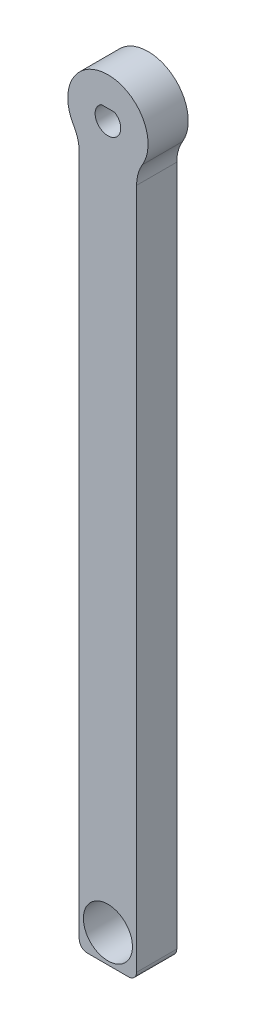
from build123d import *

# Parameters (mm, degrees)
SKETCH1_R           = 10
BOSS_EXTRUDE1_DEPTH = 10
CUT_EXTRUDE1_DEPTH  = 10
SKETCH3_W           = 14.282856858
SKETCH3_H           = 10
BOSS_EXTRUDE2_DEPTH = 175
SKETCH4_R           = 6.11
CUT_EXTRUDE2_DEPTH  = 10
FILLET1_R           = 10
FILLET2_R           = 2


with BuildPart() as part:
    # Sketch1 → Boss-Extrude1 (new body)
    with BuildSketch(Plane.XY):
        Circle(SKETCH1_R)
        with BuildLine():
            ThreePointArc((-1.666643333, 2.72), (0, -3.19), (1.666643333, 2.72))
            Line((1.666643333, 2.72), (-1.666643333, 2.72))
        make_face(mode=Mode.SUBTRACT)
    extrude(amount=BOSS_EXTRUDE1_DEPTH)

    # Sketch2 → Cut-Extrude1 (cut)
    with BuildSketch(Plane(origin=(0, 0, 0), x_dir=(-1, 0, 0), z_dir=(0, 0, -1))):
        with BuildLine():
            Line((7.141428429, -7), (-7.141428429, -7))
            ThreePointArc((-7.141428429, -7), (-3.872983346, -9.219544457), (0, -10))
            ThreePointArc((0, -10), (3.872983346, -9.219544457), (7.141428429, -7))
        make_face()
    extrude(amount=-CUT_EXTRUDE1_DEPTH, mode=Mode.SUBTRACT)

    # Sketch3 → Boss-Extrude2 (add)
    with BuildSketch(Plane.XZ.offset(7)):
        with Locations((0, 5)):
            Rectangle(SKETCH3_W, SKETCH3_H)
    extrude(amount=BOSS_EXTRUDE2_DEPTH)

    # Sketch4 → Cut-Extrude2 (cut)
    with BuildSketch(Plane(origin=(0, 0, 0), x_dir=(-1, 0, 0), z_dir=(0, 0, -1))):
        with Locations((0, -175)):
            Circle(SKETCH4_R)
    extrude(amount=-CUT_EXTRUDE2_DEPTH, mode=Mode.SUBTRACT)

    # Fillet1
    fillet1_edges = [part.edges().sort_by_distance(p)[0] for p in [
        (7.141428429, -7, 5),
        (-7.141428429, -7, 5),
    ]]
    fillet(fillet1_edges, radius=FILLET1_R)

    # Fillet2
    fillet2_edges = [part.edges().sort_by_distance(p)[0] for p in [
        (-7.141428429, -182, 5),
        (7.141428429, -182, 5),
    ]]
    fillet(fillet2_edges, radius=FILLET2_R)


solid = part.part
